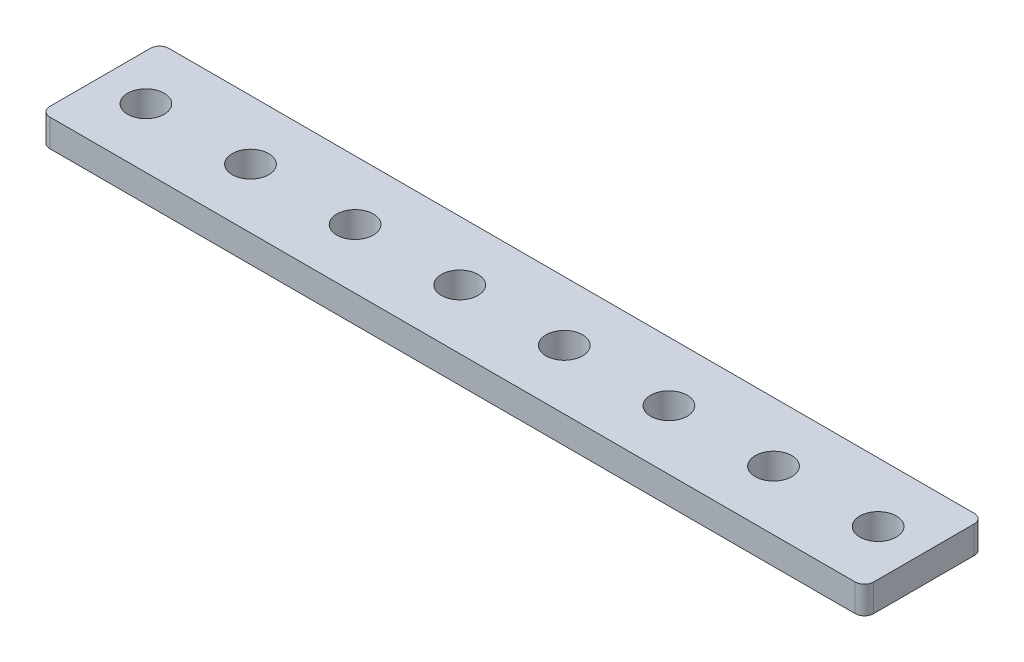
from build123d import *

# Parameters (mm, degrees)
BOSS_EXTRUDE1_DEPTH = 3
SKETCH3_R           = 2
CUT_EXTRUDE1_DEPTH  = 46.565886362


with BuildPart() as part:
    # Sketch1 → Boss-Extrude1 (new body)
    with BuildSketch(Plane(origin=(0, 0, 0), x_dir=(1, 0, 0), z_dir=(0, 1, 0))):
        with BuildLine():
            Line((-44, -6.5), (44, -6.5))
            ThreePointArc((44, -6.5), (44.707106781, -6.207106781), (45, -5.5))
            Line((45, -5.5), (45, 5.5))
            ThreePointArc((45, 5.5), (44.707106781, 6.207106781), (44, 6.5))
            Line((44, 6.5), (-44, 6.5))
            ThreePointArc((-44, 6.5), (-44.707106781, 6.207106781), (-45, 5.5))
            Line((-45, 5.5), (-45, -5.5))
            ThreePointArc((-45, -5.5), (-44.707106781, -6.207106781), (-44, -6.5))
        make_face()
    extrude(amount=BOSS_EXTRUDE1_DEPTH)

    # Sketch3 → Cut-Extrude1 (cut, through all)
    with BuildSketch(Plane(origin=(0, 3, 0), x_dir=(1, 0, 0), z_dir=(0, 1, 0))):
        with Locations(Location((-40, 0, 0), (0, 0, 270))):
            Circle(SKETCH3_R)
        with Locations(Location((-28.571428571, 0, 0), (0, 0, 270))):
            Circle(SKETCH3_R)
        with Locations(Location((-17.142857143, 0, 0), (0, 0, 270))):
            Circle(SKETCH3_R)
        with Locations(Location((-5.714285714, 0, 0), (0, 0, 270))):
            Circle(SKETCH3_R)
        with Locations(Location((5.714285714, 0, 0), (0, 0, 270))):
            Circle(SKETCH3_R)
        with Locations(Location((17.142857143, 0, 0), (0, 0, 270))):
            Circle(SKETCH3_R)
        with Locations(Location((28.571428571, 0, 0), (0, 0, 270))):
            Circle(SKETCH3_R)
        with Locations(Location((40, 0, 0), (0, 0, 270))):
            Circle(SKETCH3_R)
    extrude(amount=-CUT_EXTRUDE1_DEPTH, mode=Mode.SUBTRACT)


solid = part.part
